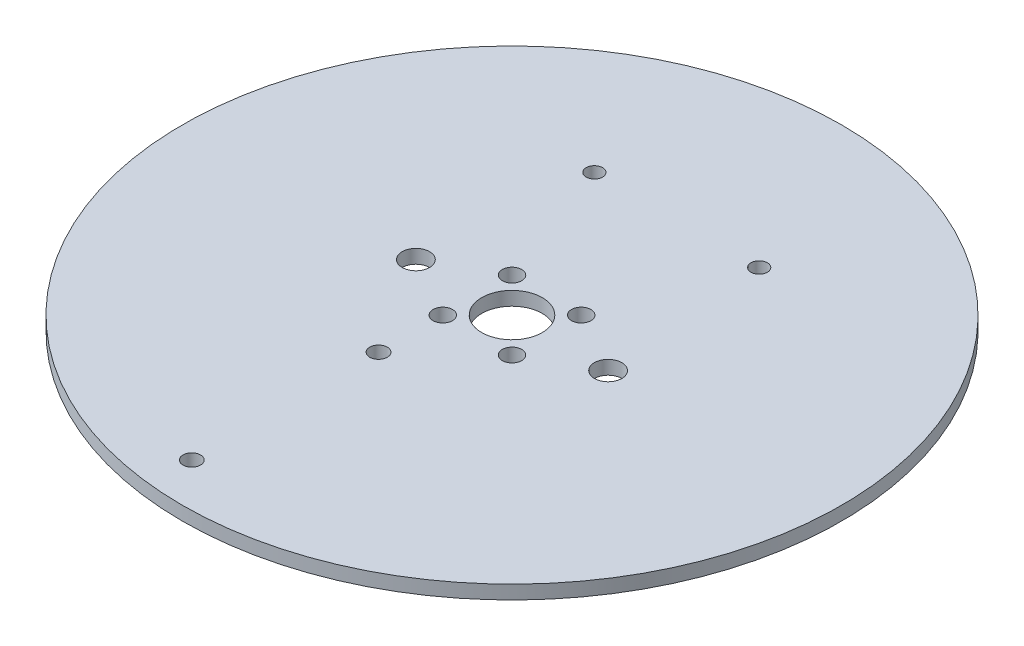
from build123d import *

# Parameters (mm, degrees)
SKETCH1_R               = 76.2
BOSS_EXTRUDE1_DEPTH     = 3.175
CUT_EXTRUDE1_REACH      = 109.81
SKETCH2_R               = 7
CUT_EXTRUDE3_DEPTH      = 108.809835474
CUT_EXTRUDE3_DEPTH_BACK = 108.809835474
SKETCH4_R               = 3.175
M4_CLEARANCE_HOLE1_D    = 4.5
CUT_EXTRUDE4_REACH      = 109.81
SKETCH8_R               = 1.89865
CUT_EXTRUDE5_REACH      = 109.81
SKETCH9_R               = 2.032


with BuildPart() as part:
    # Sketch1 → Boss-Extrude1 (new body)
    with BuildSketch(Plane(origin=(0, 0, 0), x_dir=(1, 0, 0), z_dir=(0, 1, 0))):
        with Locations(Location((0, 0, 0), (0, 0, 270))):
            Circle(SKETCH1_R)
    extrude(amount=BOSS_EXTRUDE1_DEPTH)

    # Sketch2 → Cut-Extrude1 (cut, up to next)
    with BuildSketch(Plane(origin=(0, 3.175, 0), x_dir=(1, 0, 0), z_dir=(0, 1, 0)), mode=Mode.PRIVATE) as cut_extrude1_sk1:
        with Locations(Location((0, 0, 0), (0, 0, 270))):
            Circle(SKETCH2_R)
    cut_extrude1_tool1 = extrude(cut_extrude1_sk1.sketch, amount=-CUT_EXTRUDE1_REACH, mode=Mode.PRIVATE) & part.part
    add(cut_extrude1_tool1.solids().sort_by_distance((0, 3.175, 0))[0], mode=Mode.SUBTRACT)

    # Sketch4 → Cut-Extrude3 (cut, two sides: drawn at the far end of the back side and taken through both)
    with BuildSketch(Plane(origin=(0, 3.175, 0), x_dir=(1, 0, 0), z_dir=(0, 1, 0)).offset(-CUT_EXTRUDE3_DEPTH_BACK)):
        with Locations(Location((-22.225, 0, 0), (0, 0, 270))):
            Circle(SKETCH4_R)
        with Locations(Location((22.225, 0, 0), (0, 0, 270))):
            Circle(SKETCH4_R)
    extrude(amount=CUT_EXTRUDE3_DEPTH + CUT_EXTRUDE3_DEPTH_BACK, mode=Mode.SUBTRACT)

    # M4 Clearance Hole1 (through all)
    with Locations(Plane(origin=(0, 3.175, 0), x_dir=(1, 0, 0), z_dir=(0, 1, 0))):
        with Locations((-8, 8), (8, 8), (8, -8), (-8, -8)):
            Hole(M4_CLEARANCE_HOLE1_D / 2)

    # Sketch8 → Cut-Extrude4 (cut, up to next)
    with BuildSketch(Plane(origin=(0, 3.175, 0), x_dir=(1, 0, 0), z_dir=(0, 1, 0)), mode=Mode.PRIVATE) as cut_extrude4_sk1:
        with Locations(Location((19.05, 38.1, 0), (0, 0, 270))):
            Circle(SKETCH8_R)
    cut_extrude4_tool1 = extrude(cut_extrude4_sk1.sketch, amount=-CUT_EXTRUDE4_REACH, mode=Mode.PRIVATE) & part.part
    # Sketch8 → Cut-Extrude4 (cut, up to next)
    with BuildSketch(Plane(origin=(0, 3.175, 0), x_dir=(1, 0, 0), z_dir=(0, 1, 0)), mode=Mode.PRIVATE) as cut_extrude4_sk2:
        with Locations(Location((-19.05, 38.1, 0), (0, 0, 270))):
            Circle(SKETCH8_R)
    cut_extrude4_tool2 = extrude(cut_extrude4_sk2.sketch, amount=-CUT_EXTRUDE4_REACH, mode=Mode.PRIVATE) & part.part
    add(cut_extrude4_tool1.solids().sort_by_distance((19.05, 3.175, -38.1))[0], mode=Mode.SUBTRACT)
    add(cut_extrude4_tool2.solids().sort_by_distance((-19.05, 3.175, -38.1))[0], mode=Mode.SUBTRACT)

    # Sketch9 → Cut-Extrude5 (cut, up to next)
    with BuildSketch(Plane.XZ, mode=Mode.PRIVATE) as cut_extrude5_sk1:
        with Locations(Location((-8, 22.86, 0), (0, 0, 270))):
            Circle(SKETCH9_R)
    cut_extrude5_tool1 = extrude(cut_extrude5_sk1.sketch, amount=-CUT_EXTRUDE5_REACH, mode=Mode.PRIVATE) & part.part
    # Sketch9 → Cut-Extrude5 (cut, up to next)
    with BuildSketch(Plane.XZ, mode=Mode.PRIVATE) as cut_extrude5_sk2:
        with Locations(Location((-8, 66.04, 0), (0, 0, 270))):
            Circle(SKETCH9_R)
    cut_extrude5_tool2 = extrude(cut_extrude5_sk2.sketch, amount=-CUT_EXTRUDE5_REACH, mode=Mode.PRIVATE) & part.part
    add(cut_extrude5_tool1.solids().sort_by_distance((-8, 0, 22.86))[0], mode=Mode.SUBTRACT)
    add(cut_extrude5_tool2.solids().sort_by_distance((-8, 0, 66.04))[0], mode=Mode.SUBTRACT)


solid = part.part
